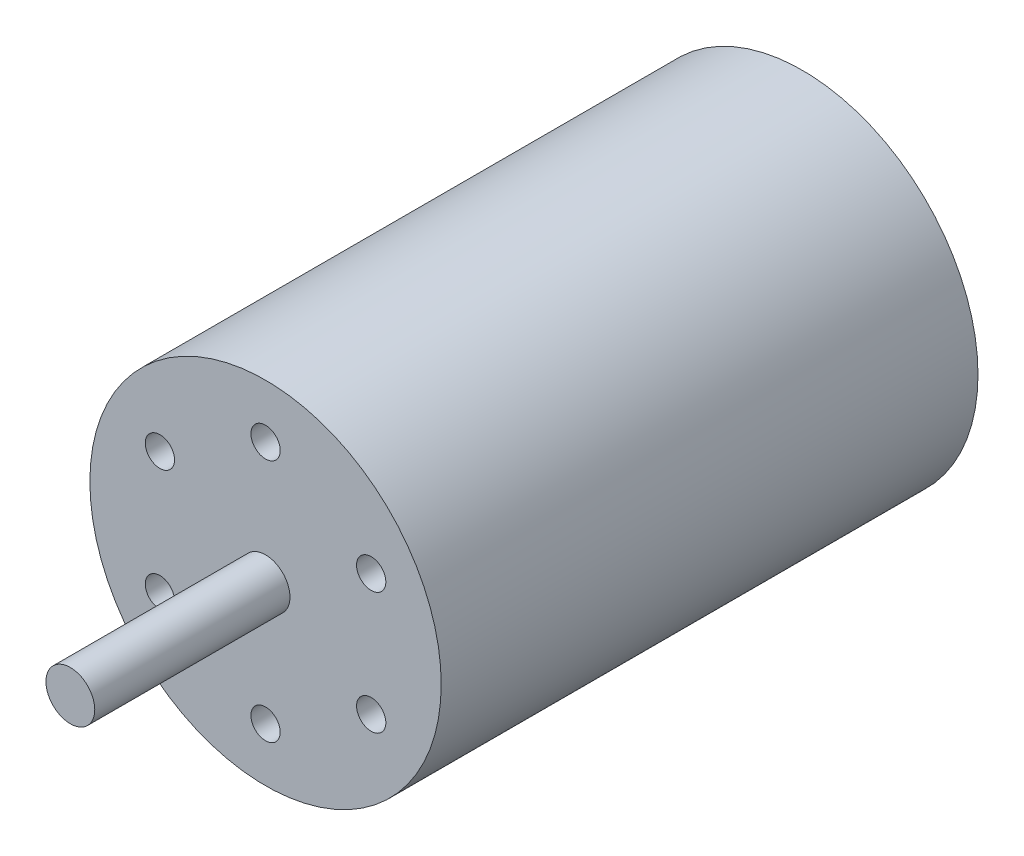
from build123d import *

# Parameters (mm, degrees)
SKETCH1_R           = 18
BOSS_EXTRUDE1_DEPTH = 55
SKETCH2_R           = 2.5
BOSS_EXTRUDE2_DEPTH = 20
SKETCH3_R           = 1.5
CUT_EXTRUDE1_DEPTH  = 10


with BuildPart() as part:
    # Sketch1 → Boss-Extrude1 (new body)
    with BuildSketch(Plane.XY):
        Circle(SKETCH1_R)
    extrude(amount=BOSS_EXTRUDE1_DEPTH)

    # Sketch2 → Boss-Extrude2 (add)
    with BuildSketch(Plane.XY.offset(55)):
        Circle(SKETCH2_R)
    extrude(amount=BOSS_EXTRUDE2_DEPTH)

    # Sketch3 → Cut-Extrude1 (cut)
    with BuildSketch(Plane.XY.offset(55)):
        with Locations((0, 12.5)):
            Circle(SKETCH3_R)
        with Locations((10.825317547, 6.25)):
            Circle(SKETCH3_R)
        with Locations((10.825317547, -6.25)):
            Circle(SKETCH3_R)
        with Locations((0, -12.5)):
            Circle(SKETCH3_R)
        with Locations((-10.825317547, -6.25)):
            Circle(SKETCH3_R)
        with Locations((-10.825317547, 6.25)):
            Circle(SKETCH3_R)
    extrude(amount=-CUT_EXTRUDE1_DEPTH, mode=Mode.SUBTRACT)


solid = part.part
